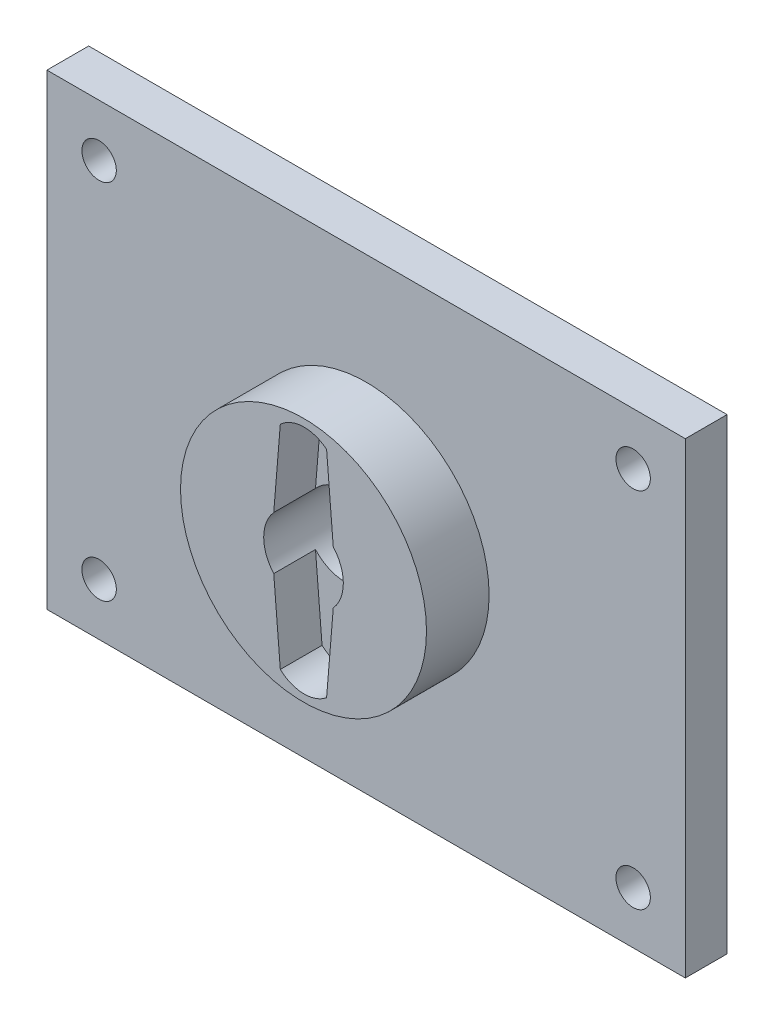
from build123d import *

# Parameters (mm, degrees)
ESQUISSE1_W             = 61.168999858
ESQUISSE1_H             = 44.751998484
ESQUISSE1_R             = 3.815511502
BOSS_EXTRU_2_DEPTH      = 4
BOSS_EXTRU_4_START      = 4
ESQUISSE2_R             = 11.783463465
BOSS_EXTRU_4_DEPTH      = 6
ENL_V_MAT_EXTRU_1_DEPTH = 4
ESQUISSE1_2_R           = 3.815511502
ENL_V_MAT_EXTRU_3_DEPTH = 40.193073087
SKETCH1_R               = 1.65
CUT_EXTRUDE1_DEPTH      = 10


with BuildPart() as part:
    # Esquisse1 → Boss.-Extru.2 (new body)
    with BuildSketch(Plane.XY):
        Rectangle(ESQUISSE1_W, ESQUISSE1_H)
        Circle(ESQUISSE1_R, mode=Mode.SUBTRACT)
    extrude(amount=BOSS_EXTRU_2_DEPTH)

    # Esquisse2 → Boss.-Extru.4 (add)
    with BuildSketch(Plane.XY.offset(BOSS_EXTRU_4_START)):
        Circle(ESQUISSE2_R)
    extrude(amount=BOSS_EXTRU_4_DEPTH)

    # Esquisse4 → Enlèv. mat.-Extru.1 (cut)
    with BuildSketch(Plane.XY.offset(10)):
        with BuildLine():
            Line((2.87019869, 2.302904251), (2.212319523, 10.306766943))
            ThreePointArc((2.212319523, 10.306766943), (-0.029730087, 11.070975118), (-2.223029733, 10.17641531))
            Line((-2.223029733, 10.17641531), (-2.870198645, 2.302904307))
            ThreePointArc((-2.870198645, 2.302904307), (-3.679865285, 0), (-2.870198645, -2.302904307))
            Line((-2.870198645, -2.302904307), (-2.223029733, -10.17641531))
            ThreePointArc((-2.223029733, -10.17641531), (-0.029730087, -11.070975118), (2.212319523, -10.306766943))
            Line((2.212319523, -10.306766943), (2.87019869, -2.302904251))
            ThreePointArc((2.87019869, -2.302904251), (3.679865285, 0), (2.87019869, 2.302904251))
        make_face()
    extrude(amount=-ENL_V_MAT_EXTRU_1_DEPTH, mode=Mode.SUBTRACT)

    # Esquisse1<2> → Enlèv. mat.-Extru.3 (cut, through all)
    with BuildSketch(Plane.XY):
        Circle(ESQUISSE1_2_R)
    extrude(amount=ENL_V_MAT_EXTRU_3_DEPTH, mode=Mode.SUBTRACT)

    # Sketch1 → Cut-Extrude1 (cut)
    with BuildSketch(Plane.XY.offset(4)):
        with Locations((-25.584499929, 17.375999242)):
            Circle(SKETCH1_R)
        with Locations((25.584499929, 17.375999242)):
            Circle(SKETCH1_R)
        with Locations((25.584499929, -17.375999242)):
            Circle(SKETCH1_R)
        with Locations((-25.584499929, -17.375999242)):
            Circle(SKETCH1_R)
    extrude(amount=-CUT_EXTRUDE1_DEPTH, mode=Mode.SUBTRACT)


solid = part.part
